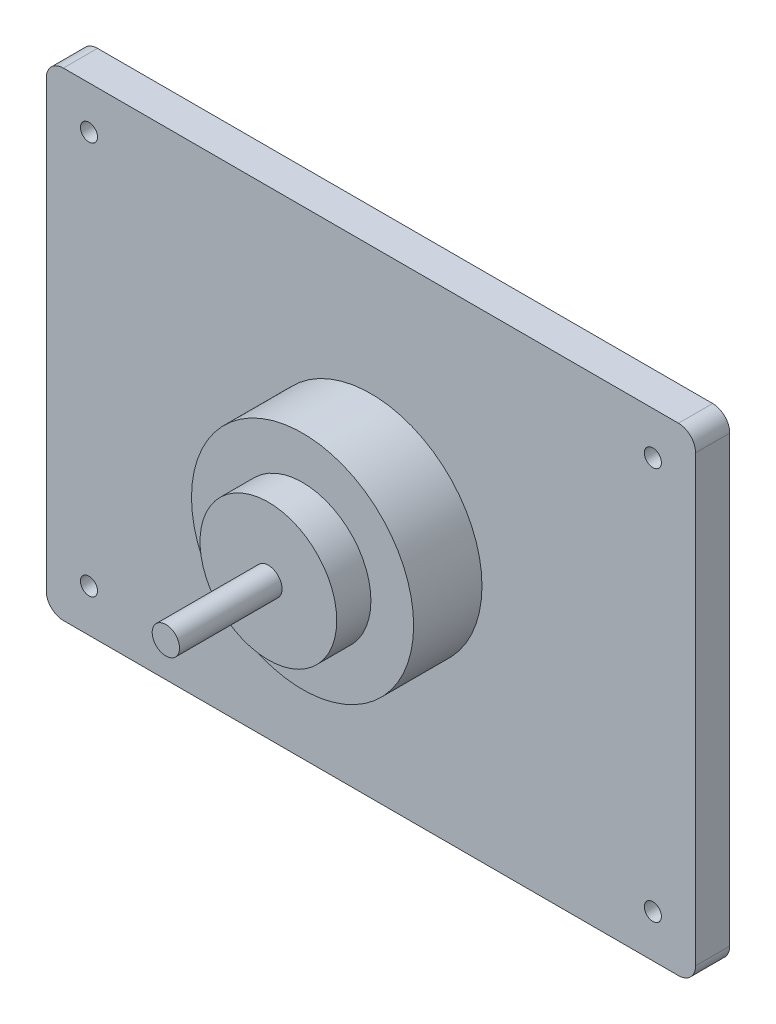
from build123d import *

# Parameters (mm, degrees)
SKETCH_1_W          = 190
SKETCH_1_H          = 140
EXTRUDE_1_DEPTH     = 10
FILLET_1_R          = 5
SKETCH_2_R          = 32.5
EXTRUDE_2_DEPTH     = 20
SKETCH_3_R          = 20
EXTRUDE_3_DEPTH     = 10
SKETCH_4_R          = 10
EXTRUDE_4_DEPTH     = 20
CUT_EXTRUDE_START   = -10
SKETCH_5_R          = 10
SKETCH_5_R_2        = 4
CUT_EXTRUDE_1_DEPTH = 10
SKETCH_6_R          = 10
SKETCH_6_R_2        = 4
CUT_EXTRUDE_2_DEPTH = 10
SKETCH_7_R          = 4
EXTRUDE_5_DEPTH     = 10
SKETCH_8_R          = 2.5
CUT_EXTRUDE_3_DEPTH = 10


with BuildPart() as part:
    # 草图1 → 凸台-拉伸1 (new body)
    with BuildSketch(Plane.XY):
        Rectangle(SKETCH_1_W, SKETCH_1_H)
    extrude(amount=EXTRUDE_1_DEPTH)

    # 圆角1
    fillet_1_edges = [part.edges().sort_by_distance(p)[0] for p in [
        (-95, -70, 5),
        (-95, 70, 5),
        (95, 70, 5),
        (95, -70, 5),
    ]]
    fillet(fillet_1_edges, radius=FILLET_1_R)

    # 草图2 → 凸台-拉伸2 (add)
    with BuildSketch(Plane.XY.offset(10)):
        Circle(SKETCH_2_R)
    extrude(amount=EXTRUDE_2_DEPTH)

    # 草图3 → 凸台-拉伸3 (add)
    with BuildSketch(Plane.XY.offset(30)):
        Circle(SKETCH_3_R)
    extrude(amount=EXTRUDE_3_DEPTH)

    # 草图4 → 凸台-拉伸4 (add)
    with BuildSketch(Plane.XY.offset(40)):
        Circle(SKETCH_4_R)
    extrude(amount=EXTRUDE_4_DEPTH)

    # 草图5 → 切除-拉伸1 (cut)
    with BuildSketch(Plane.XY.offset(60).offset(CUT_EXTRUDE_START)):
        Circle(SKETCH_5_R)
        Circle(SKETCH_5_R_2, mode=Mode.SUBTRACT)
    extrude(amount=CUT_EXTRUDE_1_DEPTH, mode=Mode.SUBTRACT)

    # 草图6 → 切除-拉伸2 (cut)
    with BuildSketch(Plane.XY.offset(50).offset(CUT_EXTRUDE_START)):
        Circle(SKETCH_6_R)
        Circle(SKETCH_6_R_2, mode=Mode.SUBTRACT)
    extrude(amount=CUT_EXTRUDE_2_DEPTH, mode=Mode.SUBTRACT)

    # 草图7 → 凸台-拉伸5 (add)
    with BuildSketch(Plane.XY.offset(60)):
        Circle(SKETCH_7_R)
    extrude(amount=EXTRUDE_5_DEPTH)

    # 草图8 → 切除-拉伸3 (cut)
    with BuildSketch(Plane.XY.offset(10)):
        with Locations((82.5, 57.5)):
            Circle(SKETCH_8_R)
        with Locations(Location((82.5, -57.5, 0), (0, 0, 180))):
            Circle(SKETCH_8_R)
        with Locations((-82.5, -57.5)):
            Circle(SKETCH_8_R)
        with Locations(Location((-82.5, 57.5, 0), (0, 0, 180))):
            Circle(SKETCH_8_R)
    extrude(amount=-CUT_EXTRUDE_3_DEPTH, mode=Mode.SUBTRACT)


solid = part.part
